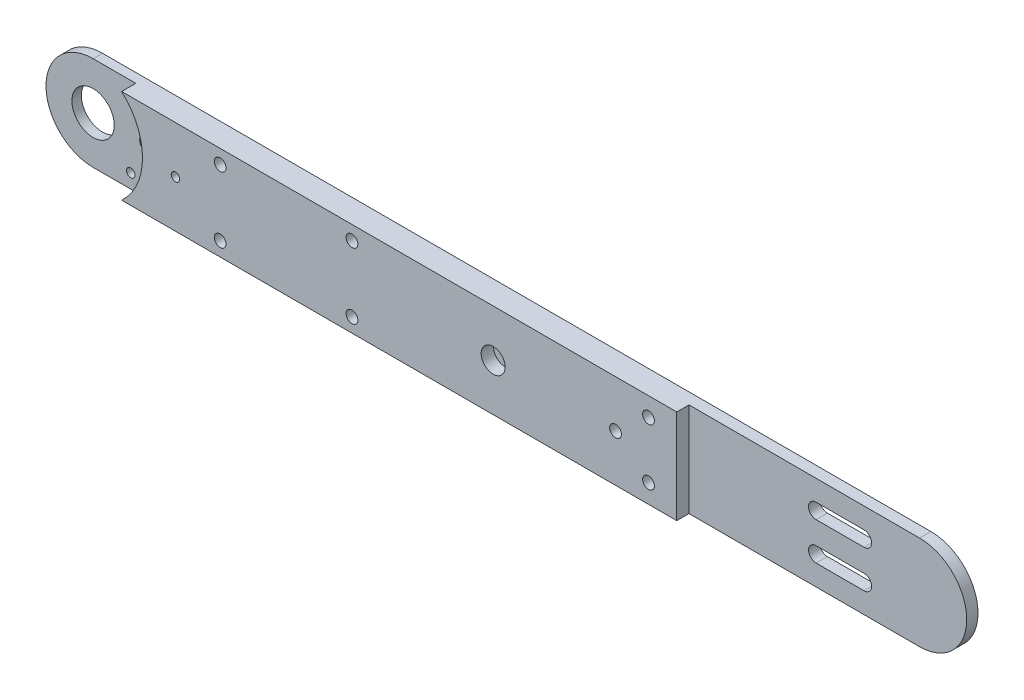
from build123d import *

# Parameters (mm, degrees)
EXTRUDE_1_DEPTH      = 5
SKETCH_1_3_R         = 1.1
CUT_EXTRUDE_2_DEPTH  = 187.33571853
SKETCH_1_4_R         = 2.55
CUT_EXTRUDE_3_DEPTH  = 2.6
SKETCH_2_R           = 1.25
CUT_EXTRUDE_4_DEPTH  = 187.33571853
CUT_EXTRUDE_START    = -5
SKETCH_2_3_R         = 2
CUT_EXTRUDE_5_DEPTH  = 2.5
SKETCH_3_W           = 59
SKETCH_3_H           = 2.6
CUT_EXTRUDE_6_DEPTH  = 188.138985783
CUT_EXTRUDE_7_DEPTH  = 187.33571853
SKETCH_5_W           = 210.843247287
SKETCH_5_H           = 25.236064347
CUT_EXTRUDE_8_DEPTH  = 187.33571853
SKETCH_6_R           = 13.5
CUT_EXTRUDE_9_DEPTH  = 3
SKETCH_7_R           = 4.5
CUT_EXTRUDE_10_DEPTH = 187.33571853
SKETCH_8_R           = 1.6
SKETCH_8_R_2         = 0.9
CUT_EXTRUDE_11_DEPTH = 187.33571853


with BuildPart() as part:
    # 草图1 → 凸台-拉伸1 (new body)
    with BuildSketch(Plane.XY):
        with BuildLine():
            Line((0, -10), (176, -10))
            ThreePointArc((176, -10), (186, 0), (176, 10))
            Line((176, 10), (0, 10))
            ThreePointArc((0, 10), (-10, 0), (0, -10))
        make_face()
    extrude(amount=EXTRUDE_1_DEPTH)

    # 草图1<3> → 切除-拉伸2 (cut, through all)
    with BuildSketch(Plane.XY):
        with Locations((88, 0)):
            Circle(SKETCH_1_3_R)
        Circle(SKETCH_1_3_R)
    extrude(amount=CUT_EXTRUDE_2_DEPTH, mode=Mode.SUBTRACT)

    # 草图1<4> → 切除-拉伸3 (cut)
    with BuildSketch(Plane.XY):
        with Locations((88, 0)):
            Circle(SKETCH_1_4_R)
        Circle(SKETCH_1_4_R)
    extrude(amount=CUT_EXTRUDE_3_DEPTH, mode=Mode.SUBTRACT)

    # 草图2 → 切除-拉伸4 (cut, through all)
    with BuildSketch(Plane(origin=(0, 0, 0), x_dir=(-1, 0, 0), z_dir=(0, 0, -1))):
        with Locations((-121, -6)):
            Circle(SKETCH_2_R)
        with Locations((-121, 6)):
            Circle(SKETCH_2_R)
        with Locations((-114, 0)):
            Circle(SKETCH_2_R)
        with Locations((-58, 7)):
            Circle(SKETCH_2_R)
        with Locations((-30, 7)):
            Circle(SKETCH_2_R)
        with Locations((-58, -7)):
            Circle(SKETCH_2_R)
        with Locations((-30, -7)):
            Circle(SKETCH_2_R)
    extrude(amount=-CUT_EXTRUDE_4_DEPTH, mode=Mode.SUBTRACT)

    # 草图2<3> → 切除-拉伸5 (cut)
    with BuildSketch(Plane(origin=(0, 0, 0), x_dir=(-1, 0, 0), z_dir=(0, 0, -1)).offset(CUT_EXTRUDE_START)):
        with Locations(Location((-121, -6, 0), (0, 0, 180))):
            Circle(SKETCH_2_3_R)
        with Locations(Location((-121, 6, 0), (0, 0, 180))):
            Circle(SKETCH_2_3_R)
        with Locations(Location((-114, 0, 0), (0, 0, 180))):
            Circle(SKETCH_2_3_R)
        with Locations(Location((-58, 7, 0), (0, 0, 180))):
            Circle(SKETCH_2_3_R)
        with Locations(Location((-30, 7, 0), (0, 0, 180))):
            Circle(SKETCH_2_3_R)
        with Locations(Location((-58, -7, 0), (0, 0, 180))):
            Circle(SKETCH_2_3_R)
        with Locations(Location((-30, -7, 0), (0, 0, 180))):
            Circle(SKETCH_2_3_R)
    extrude(amount=CUT_EXTRUDE_5_DEPTH, mode=Mode.SUBTRACT)

    # 草图3 → 切除-拉伸6 (cut, through all)
    with BuildSketch(Plane(origin=(0, 10, 0), x_dir=(1, 0, 0), z_dir=(0, 1, 0))):
        with Locations((156.5, -1.3)):
            Rectangle(SKETCH_3_W, SKETCH_3_H)
    extrude(amount=-CUT_EXTRUDE_6_DEPTH, mode=Mode.SUBTRACT)

    # 草图4 → 切除-拉伸7 (cut, through all)
    with BuildSketch(Plane.XY.offset(5)):
        with BuildLine():
            Line((164.2, -2.4), (154, -2.4))
            ThreePointArc((154, -2.4), (152.4, -4), (154, -5.6))
            Line((154, -5.6), (164.2, -5.6))
            ThreePointArc((164.2, -5.6), (165.8, -4), (164.2, -2.4))
        make_face()
        with BuildLine():
            ThreePointArc((154, 5.6), (152.4, 4), (154, 2.4))
            Line((154, 2.4), (164.2, 2.4))
            ThreePointArc((164.2, 2.4), (165.8, 4), (164.2, 5.6))
            Line((164.2, 5.6), (154, 5.6))
        make_face()
    extrude(amount=-CUT_EXTRUDE_7_DEPTH, mode=Mode.SUBTRACT)

    # 镜向1: part across plane


with BuildPart() as part_1:
    add(part.part)
    add(part.part.mirror(Plane.XY))

    # 草图5 → 切除-拉伸8 (cut, through all)
    with BuildSketch(Plane.XY):
        with Locations((85.761316873, -1.017583239)):
            Rectangle(SKETCH_5_W, SKETCH_5_H)
    extrude(amount=CUT_EXTRUDE_8_DEPTH, mode=Mode.SUBTRACT)

    # 草图6 → 切除-拉伸9 (cut)
    with BuildSketch(Plane.XY):
        Circle(SKETCH_6_R)
    extrude(amount=-CUT_EXTRUDE_9_DEPTH, mode=Mode.SUBTRACT)

    # 草图7 → 切除-拉伸10 (cut, through all)
    with BuildSketch(Plane(origin=(0, 0, -5), x_dir=(-1, 0, 0), z_dir=(0, 0, -1))):
        Circle(SKETCH_7_R)
    extrude(amount=-CUT_EXTRUDE_10_DEPTH, mode=Mode.SUBTRACT)

    # 草图8 → 切除-拉伸11 (cut, through all)
    with BuildSketch(Plane(origin=(0, 0, -5), x_dir=(-1, 0, 0), z_dir=(0, 0, -1))):
        with Locations((-11.5, 0)):
            Circle(SKETCH_8_R)
        with Locations((-8, 7)):
            Circle(SKETCH_8_R_2)
        with Locations((-8, -7)):
            Circle(SKETCH_8_R_2)
        with Locations((-20.5, 0)):
            Circle(SKETCH_8_R_2)
    extrude(amount=-CUT_EXTRUDE_11_DEPTH, mode=Mode.SUBTRACT)


solid = part_1.part
